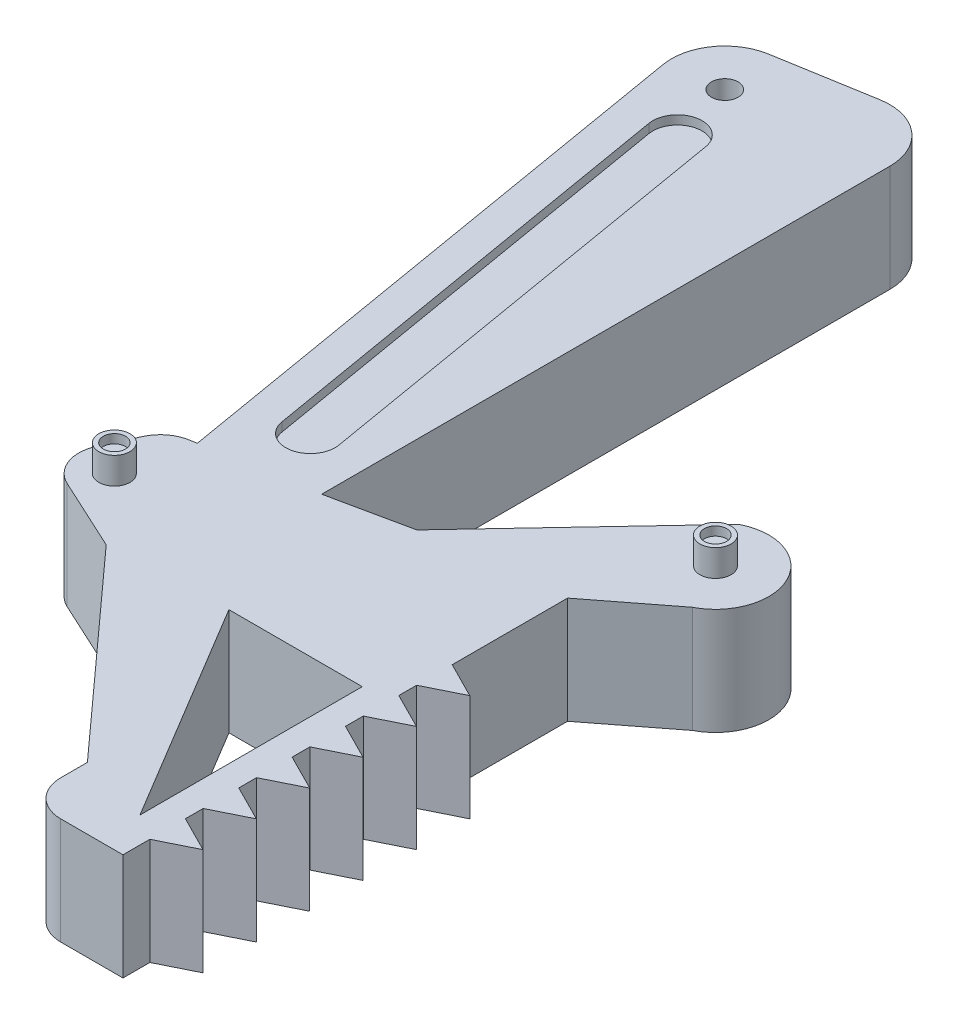
from build123d import *

# Parameters (mm, degrees)
BOSS_EXTRUDE1_DEPTH = 6
FILLET1_R           = 6
FILLET2_R           = 4
BOSS_EXTRUDE2_DEPTH = 12
LPATTERN1_COUNT     = 6
LPATTERN1_PITCH     = 6
CUT_EXTRUDE1_DEPTH  = 26
SKETCH5_R           = 1.5
CUT_EXTRUDE4_DEPTH  = 124.180869367
SKETCH6_R           = 1.75
BOSS_EXTRUDE3_DEPTH = 3
SKETCH7_R           = 1.25
CUT_EXTRUDE6_DEPTH  = 1
SKETCH8_R           = 1.25
CUT_EXTRUDE7_DEPTH  = 1
CUT_EXTRUDE8_DEPTH  = 1


with BuildPart() as part:
    # Sketch1 → Boss-Extrude1 (new, symmetric)
    with BuildSketch(Plane(origin=(0, 0, 0), x_dir=(1, 0, 0), z_dir=(0, 1, 0))):
        with BuildLine():
            ThreePointArc((13.432245527, -50.487906924), (21.509028276, -53.088979862), (18.907955338, -61.165762611))
            Line((18.907955338, -61.165762611), (11, -67.286566673))
            Line((11, -67.286566673), (11, -117.286566673))
            Line((11, -117.286566673), (0, -117.286566673))
            Line((0, -117.286566673), (0, -110.286566673))
            Line((0, -110.286566673), (-20.129396013, -88.042299634))
            Line((-20.129396013, -88.042299634), (-31.928362438, -82.58479184))
            Line((-31.928362438, -82.58479184), (-27.730279519, -73.508663821))
            Line((-27.730279519, -73.508663821), (-24.896421124, -73.027946621))
            Line((-24.896421124, -73.027946621), (-12.941547125, -71))
            Line((-12.941547125, -71), (-4.10711559, -69.126148868))
            Line((-4.10711559, -69.126148868), (13.432245527, -50.487906924))
        make_face()
        Polygon((-12.941547125, -71), (-24.896421124, -73.027946621), (-36.603518956, -4.013862114), (-12.941547125, 0), align=None)
    extrude(amount=BOSS_EXTRUDE1_DEPTH, both=True)

    # Fillet1
    fillet1_edges = [part.edges().sort_by_distance(p)[0] for p in [
        (-36.603518956, 0, 4.013862114),
        (-12.941547125, 0, 0),
    ]]
    fillet(fillet1_edges, radius=FILLET1_R)

    # Fillet2
    fillet2_edges = [part.edges().sort_by_distance(p)[0] for p in [
        (0, 0, 117.286566673),
        (-31.928362438, 0, 82.58479184),
        (-27.730279519, 0, 73.508663821),
    ]]
    fillet(fillet2_edges, radius=FILLET2_R)

    # Sketch2 → Boss-Extrude2 (add)
    with BuildSketch(Plane(origin=(0, 6, 0), x_dir=(1, 0, 0), z_dir=(0, 1, 0))):
        Polygon((15, -112.286566673), (11, -114.265571656), (11, -110.265571656), align=None)
    boss_extrude2 = extrude(amount=-BOSS_EXTRUDE2_DEPTH)

    # LPattern1: Boss-Extrude2 ×6
    with Locations(*[(0, 0, -i * LPATTERN1_PITCH) for i in range(1, LPATTERN1_COUNT)]):
        add(boss_extrude2)

    # Sketch3 → Cut-Extrude1 (cut)
    with BuildSketch(Plane(origin=(0, 6, 0), x_dir=(1, 0, 0), z_dir=(0, 1, 0))):
        Polygon((8.082911966, -112.457569416), (8.082911966, -87.457569416), (-6.917088034, -87.457569416), align=None)
    extrude(amount=-CUT_EXTRUDE1_DEPTH, mode=Mode.SUBTRACT)

    # Sketch5 → Cut-Extrude4 (cut, through all)
    with BuildSketch(Plane(origin=(0, 6, 0), x_dir=(1, 0, 0), z_dir=(0, 1, 0))):
        with Locations(Location((-29.68456047, -8.925889543, 0), (0, 0, 270))):
            Circle(SKETCH5_R)
    extrude(amount=-CUT_EXTRUDE4_DEPTH, mode=Mode.SUBTRACT)

    # Sketch6 → Boss-Extrude3 (add)
    with BuildSketch(Plane(origin=(0, 6, 0), x_dir=(1, 0, 0), z_dir=(0, 1, 0))):
        with Locations(Location((-26.618678063, -80.6335738, 0), (0, 0, 270))):
            Circle(SKETCH6_R)
        with Locations(Location((16.170100432, -55.826834767, 0), (0, 0, 270))):
            Circle(SKETCH6_R)
    boss_extrude3 = extrude(amount=BOSS_EXTRUDE3_DEPTH)

    # Sketch7 → Cut-Extrude6 (cut)
    with BuildSketch(Plane(origin=(0, 9, 0), x_dir=(1, 0, 0), z_dir=(0, 1, 0))):
        with Locations(Location((-26.618678063, -80.6335738, 0), (0, 0, 270))):
            Circle(SKETCH7_R)
    extrude(amount=-CUT_EXTRUDE6_DEPTH, mode=Mode.SUBTRACT)

    # Sketch8 → Cut-Extrude7 (cut)
    with BuildSketch(Plane(origin=(0, 9, 0), x_dir=(1, 0, 0), z_dir=(0, 1, 0))):
        with Locations(Location((16.170100432, -55.826834767, 0), (0, 0, 270))):
            Circle(SKETCH8_R)
    extrude(amount=-CUT_EXTRUDE7_DEPTH, mode=Mode.SUBTRACT)

    # Sketch9 → Cut-Extrude8 (cut)
    with BuildSketch(Plane(origin=(0, 6, 0), x_dir=(1, 0, 0), z_dir=(0, 1, 0))):
        with BuildLine():
            Line((-25.196199852, -15.539852581), (-16.757464085, -65.251677823))
            ThreePointArc((-16.757464085, -65.251677823), (-19.027845143, -68.450467492), (-22.226634811, -66.180086434))
            Line((-22.226634811, -66.180086434), (-30.665370577, -16.468261192))
            ThreePointArc((-30.665370577, -16.468261192), (-28.39498952, -13.269471524), (-25.196199852, -15.539852581))
        make_face()
    cut_extrude8 = extrude(amount=-CUT_EXTRUDE8_DEPTH, mode=Mode.SUBTRACT)

    # Mirror1: Boss-Extrude3, Cut-Extrude8 across plane
    add(boss_extrude3.mirror(Plane.ZX))
    add(cut_extrude8.mirror(Plane.ZX), mode=Mode.SUBTRACT)


solid = part.part
